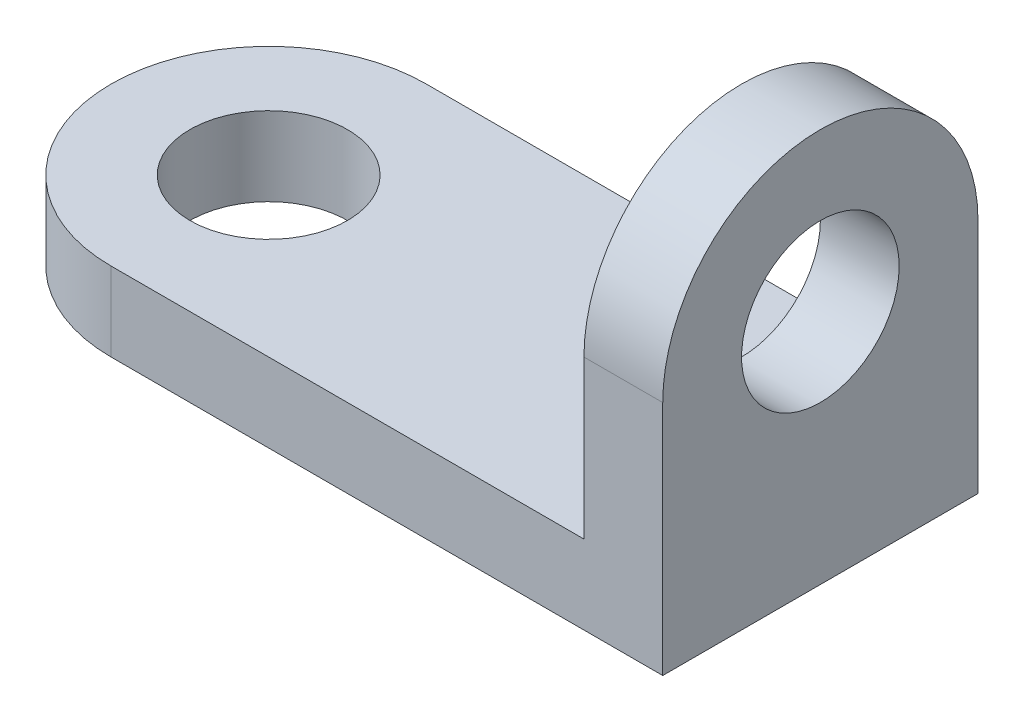
from build123d import *

# Parameters (mm, degrees)
SKETCH1_R           = 10
BOSS_EXTRUDE1_DEPTH = 10
SKETCH3_R           = 10
BOSS_EXTRUDE2_DEPTH = 10


with BuildPart() as part:
    # Sketch1 → Boss-Extrude1 (new body)
    with BuildSketch(Plane(origin=(0, 0, 0), x_dir=(1, 0, 0), z_dir=(0, 1, 0))):
        with BuildLine():
            Line((-35, 20), (35, 20))
            Line((35, 20), (35, -20))
            Line((35, -20), (-35, -20))
            ThreePointArc((-35, -20), (-55, 0), (-35, 20))
        make_face()
        with Locations(Location((-35, 0, 0), (0, 0, 270))):
            Circle(SKETCH1_R, mode=Mode.SUBTRACT)
    extrude(amount=BOSS_EXTRUDE1_DEPTH)

    # Sketch3 → Boss-Extrude2 (add)
    with BuildSketch(Plane(origin=(35, 0, 0), x_dir=(0, 0, -1), z_dir=(1, 0, 0))):
        with BuildLine():
            Line((-20, 10), (20, 10))
            Line((20, 10), (20, 30))
            ThreePointArc((20, 30), (0, 50), (-20, 30))
            Line((-20, 30), (-20, 10))
        make_face()
        with Locations((0, 30)):
            Circle(SKETCH3_R, mode=Mode.SUBTRACT)
    extrude(amount=-BOSS_EXTRUDE2_DEPTH)


solid = part.part
